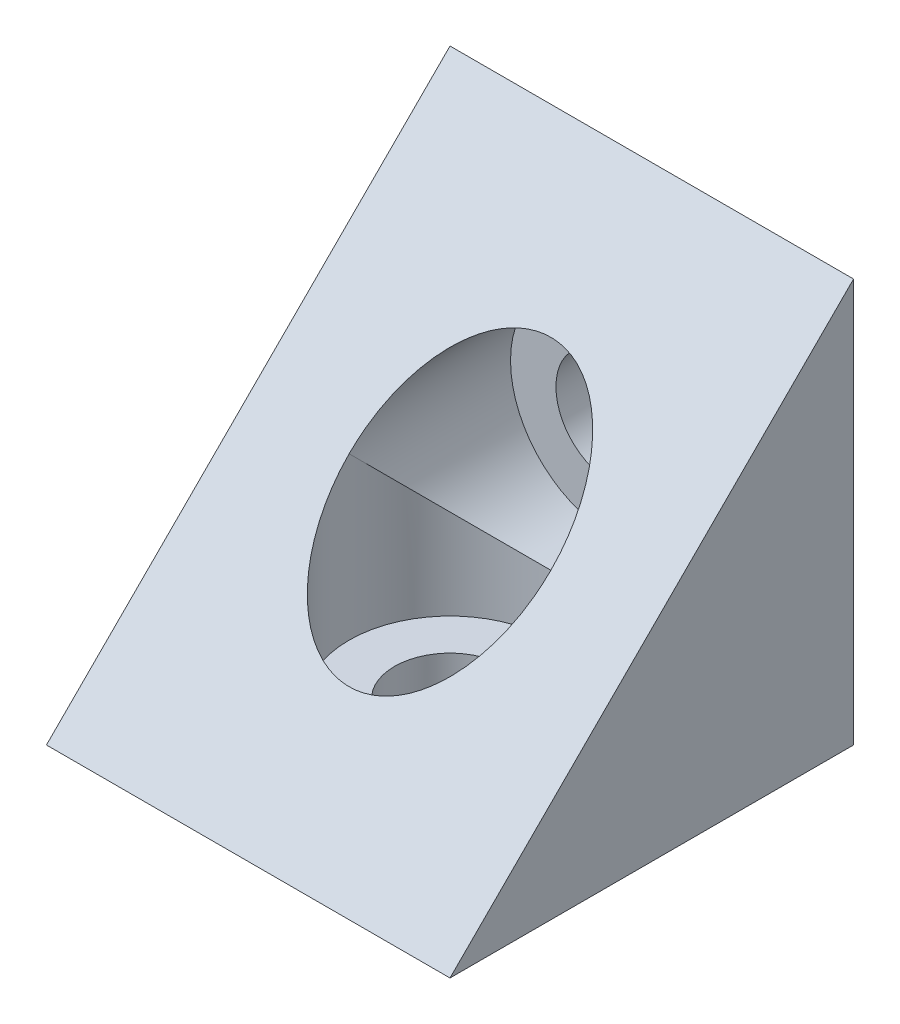
from build123d import *

# Parameters (mm, degrees)
CORNER_BASE_DEPTH      = 10
CORNER_BASE_DEPTH_BACK = 10
SKETCH2_R              = 2.75
SCREW_SHAFT_1_DEPTH    = 31
SKETCH3_R              = 2.75
SCREW_SHAFT_2_DEPTH    = 31
SKETCH4_R              = 5
SCREW_SOCKET_1_DEPTH   = 29.705400189
SKETCH5_R              = 5
CUT_EXTRUDE4_DEPTH     = 29.705400189


with BuildPart() as part:
    # Sketch1 → corner base (new, two sides: drawn at the far end of the back side and taken through both)
    with BuildSketch(Plane(origin=(0, 0, 0), x_dir=(0, 0, -1), z_dir=(1, 0, 0)).offset(-CORNER_BASE_DEPTH_BACK)):
        Polygon((0, 0), (0, 20), (-20, 0), align=None)
    extrude(amount=CORNER_BASE_DEPTH + CORNER_BASE_DEPTH_BACK)

    # Sketch2 → screw shaft 1 (cut, through all)
    with BuildSketch(Plane.XZ):
        with Locations((0, 10)):
            Circle(SKETCH2_R)
    extrude(amount=-SCREW_SHAFT_1_DEPTH, mode=Mode.SUBTRACT)

    # Sketch3 → screw shaft 2 (cut, through all)
    with BuildSketch(Plane(origin=(0, 0, 0), x_dir=(-1, 0, 0), z_dir=(0, 0, -1))):
        with Locations((0, 10)):
            Circle(SKETCH3_R)
    extrude(amount=-SCREW_SHAFT_2_DEPTH, mode=Mode.SUBTRACT)

    # Sketch4 → screw socket 1 (cut, through all)
    with BuildSketch(Plane.XY.offset(2)):
        with Locations((0, 10)):
            Circle(SKETCH4_R)
    extrude(amount=SCREW_SOCKET_1_DEPTH, mode=Mode.SUBTRACT)

    # Sketch5 → Cut-Extrude4 (cut, through all)
    with BuildSketch(Plane(origin=(0, 2, 0), x_dir=(1, 0, 0), z_dir=(0, 1, 0))):
        with Locations((0, -10)):
            Circle(SKETCH5_R)
    extrude(amount=CUT_EXTRUDE4_DEPTH, mode=Mode.SUBTRACT)


solid = part.part
